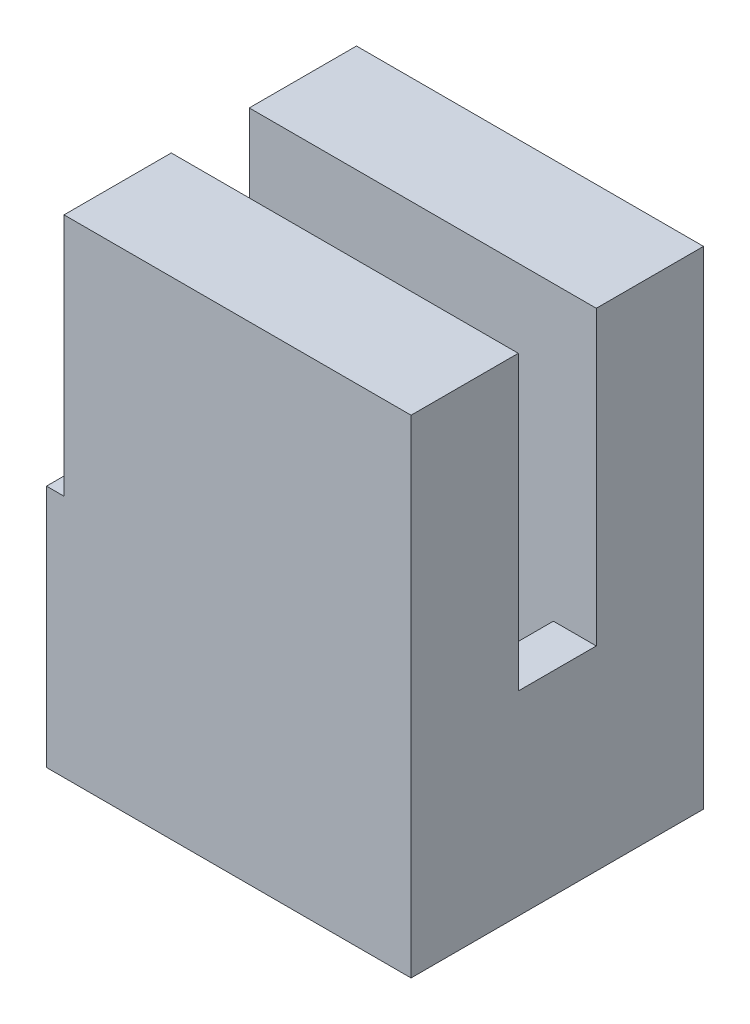
from build123d import *

# Parameters (mm, degrees)
SKETCH1_W           = 47.498
SKETCH1_H           = 38.1
BOSS_EXTRUDE1_DEPTH = 63.5
SKETCH3_W           = 47.498
SKETCH3_H           = 10.16
CUT_EXTRUDE1_DEPTH  = 38.1
SKETCH4_W           = 41.91
SKETCH4_H           = 17.145
CUT_EXTRUDE2_DEPTH  = 19.05
SKETCH5_W           = 40.132
SKETCH5_H           = 10.16
CUT_EXTRUDE3_DEPTH  = 49.770149692
SKETCH6_W           = 2.286
SKETCH6_H           = 38.1
CUT_EXTRUDE4_DEPTH  = 31.75


with BuildPart() as part:
    # Sketch1 → Boss-Extrude1 (new body)
    with BuildSketch(Plane(origin=(0, 0, 0), x_dir=(1, 0, 0), z_dir=(0, 1, 0))):
        Rectangle(SKETCH1_W, SKETCH1_H)
    extrude(amount=BOSS_EXTRUDE1_DEPTH)

    # Sketch3 → Cut-Extrude1 (cut)
    with BuildSketch(Plane(origin=(0, 63.5, 0), x_dir=(1, 0, 0), z_dir=(0, 1, 0))):
        Rectangle(SKETCH3_W, SKETCH3_H)
    extrude(amount=-CUT_EXTRUDE1_DEPTH, mode=Mode.SUBTRACT)

    # Sketch4 → Cut-Extrude2 (cut)
    with BuildSketch(Plane.XZ):
        with Locations((-2.794, 0)):
            Rectangle(SKETCH4_W, SKETCH4_H)
    extrude(amount=-CUT_EXTRUDE2_DEPTH, mode=Mode.SUBTRACT)

    # Sketch5 → Cut-Extrude3 (cut, through all)
    with BuildSketch(Plane(origin=(0, 25.4, 0), x_dir=(1, 0, 0), z_dir=(0, 1, 0))):
        with Locations((-1.905, 0)):
            Rectangle(SKETCH5_W, SKETCH5_H)
    extrude(amount=-CUT_EXTRUDE3_DEPTH, mode=Mode.SUBTRACT)

    # Sketch6 → Cut-Extrude4 (cut)
    with BuildSketch(Plane(origin=(0, 63.5, 0), x_dir=(1, 0, 0), z_dir=(0, 1, 0))):
        with Locations((-22.606, 0)):
            Rectangle(SKETCH6_W, SKETCH6_H)
    extrude(amount=-CUT_EXTRUDE4_DEPTH, mode=Mode.SUBTRACT)


solid = part.part
